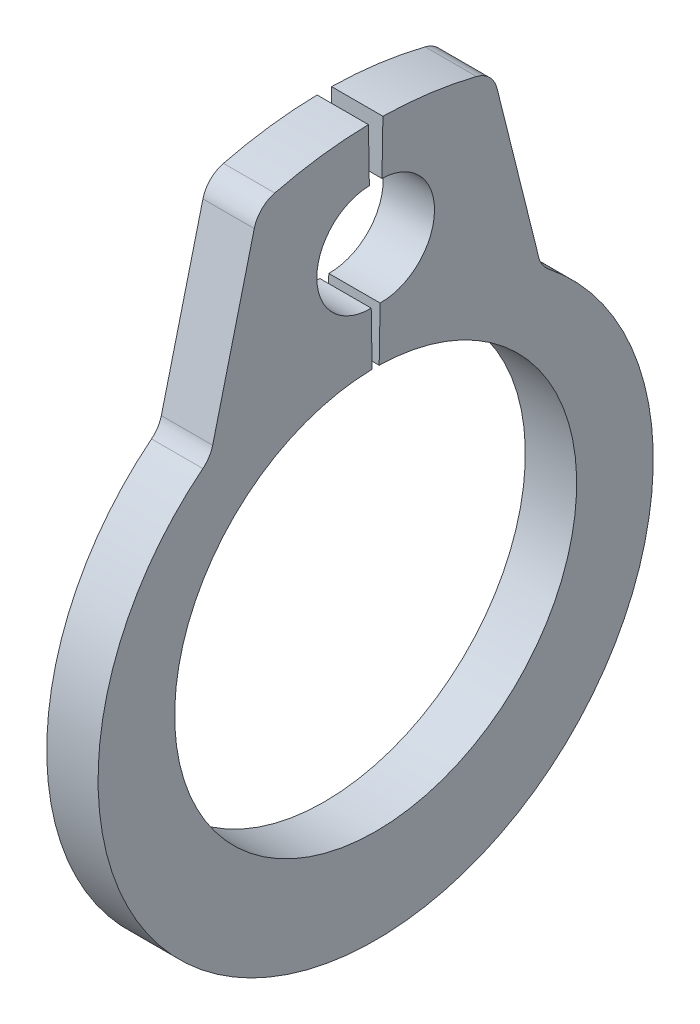
from build123d import *

# Parameters (mm, degrees)
EXTRUDE1_DEPTH = 0.3
FILLET1_R      = 0.33


with BuildPart() as part:
    # Sketch1 → Extrude1 (new, symmetric)
    with BuildSketch(Plane(origin=(0, 0, 0), x_dir=(0, 0, -1), z_dir=(1, 0, 0))):
        with BuildLine():
            Line((0.041013155, 2.349642084), (0.051920909, 2.974546893))
            ThreePointArc((0.051920909, 2.974546893), (0.687733473, 3.588543949), (0.073736417, 4.224356512))
            Line((0.073736417, 4.224356512), (0.084644171, 4.849261322))
            ThreePointArc((0.084644171, 4.849261322), (0.735227318, 4.793948351), (1.372485325, 4.651750642))
            Line((1.372485325, 4.651750642), (1.933459099, 2.401807727))
            ThreePointArc((1.933459099, 2.401807727), (0, -3.45), (-1.933459099, 2.401807727))
            Line((-1.933459099, 2.401807727), (-1.372485325, 4.651750642))
            ThreePointArc((-1.372485325, 4.651750642), (-0.735227318, 4.793948351), (-0.084644171, 4.849261322))
            Line((-0.084644171, 4.849261322), (-0.073736417, 4.224356512))
            ThreePointArc((-0.073736417, 4.224356512), (-0.687733473, 3.588543949), (-0.051920909, 2.974546893))
            Line((-0.051920909, 2.974546893), (-0.041013155, 2.349642084))
            ThreePointArc((-0.041013155, 2.349642084), (0, -2.35), (0.041013155, 2.349642084))
        make_face()
    extrude(amount=EXTRUDE1_DEPTH, both=True)

    # Fillet1
    fillet1_edges = [part.edges().sort_by_distance(p)[0] for p in [
        (0, 4.651750642, -1.372485325),
        (0, 2.401807727, -1.933459099),
        (0, 2.401807727, 1.933459099),
        (0, 4.651750642, 1.372485325),
    ]]
    fillet(fillet1_edges, radius=FILLET1_R)


solid = part.part
